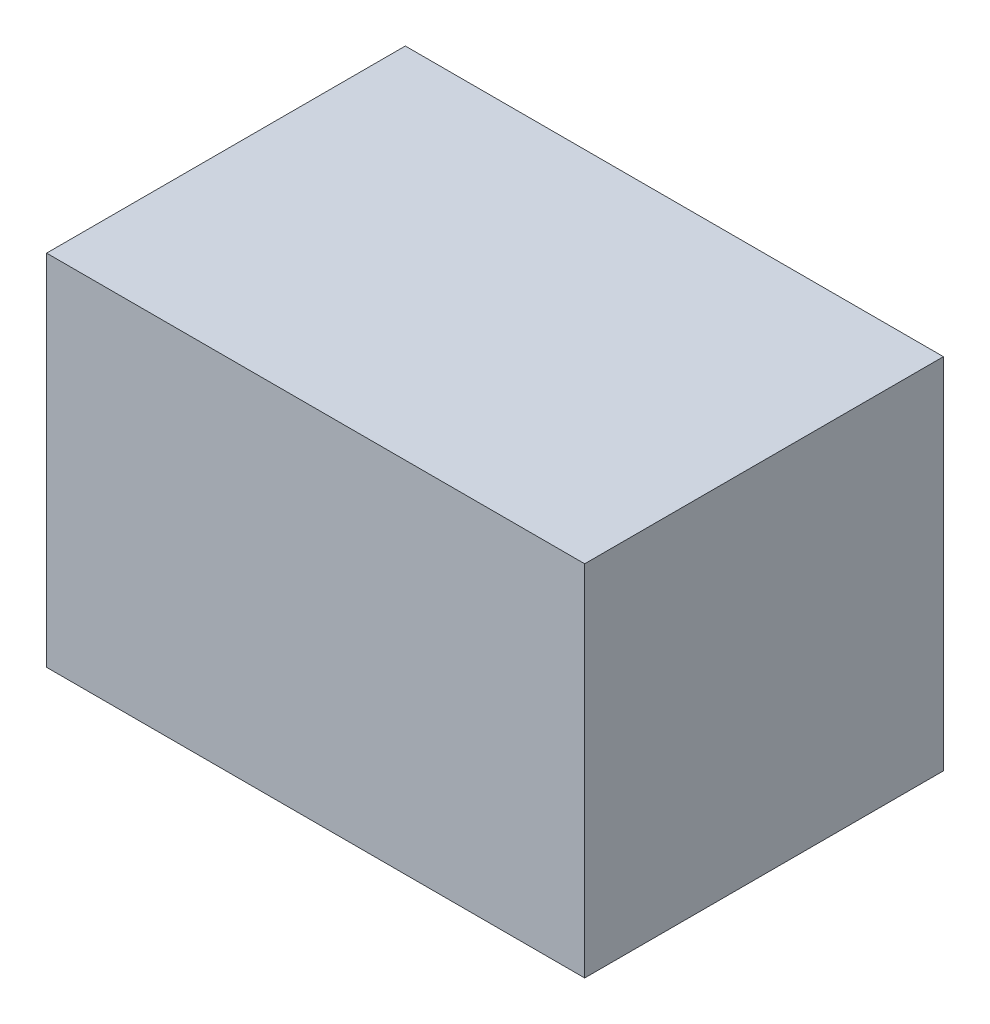
from build123d import *

# Parameters (mm, degrees)
SKETCH1_W           = 150
SKETCH1_H           = 100
BOSS_EXTRUDE1_DEPTH = 100


with BuildPart() as part:
    # Sketch1 → Boss-Extrude1 (new body)
    with BuildSketch(Plane(origin=(0, 0, 0), x_dir=(1, 0, 0), z_dir=(0, 1, 0))):
        Rectangle(SKETCH1_W, SKETCH1_H)
    extrude(amount=BOSS_EXTRUDE1_DEPTH)


solid = part.part
